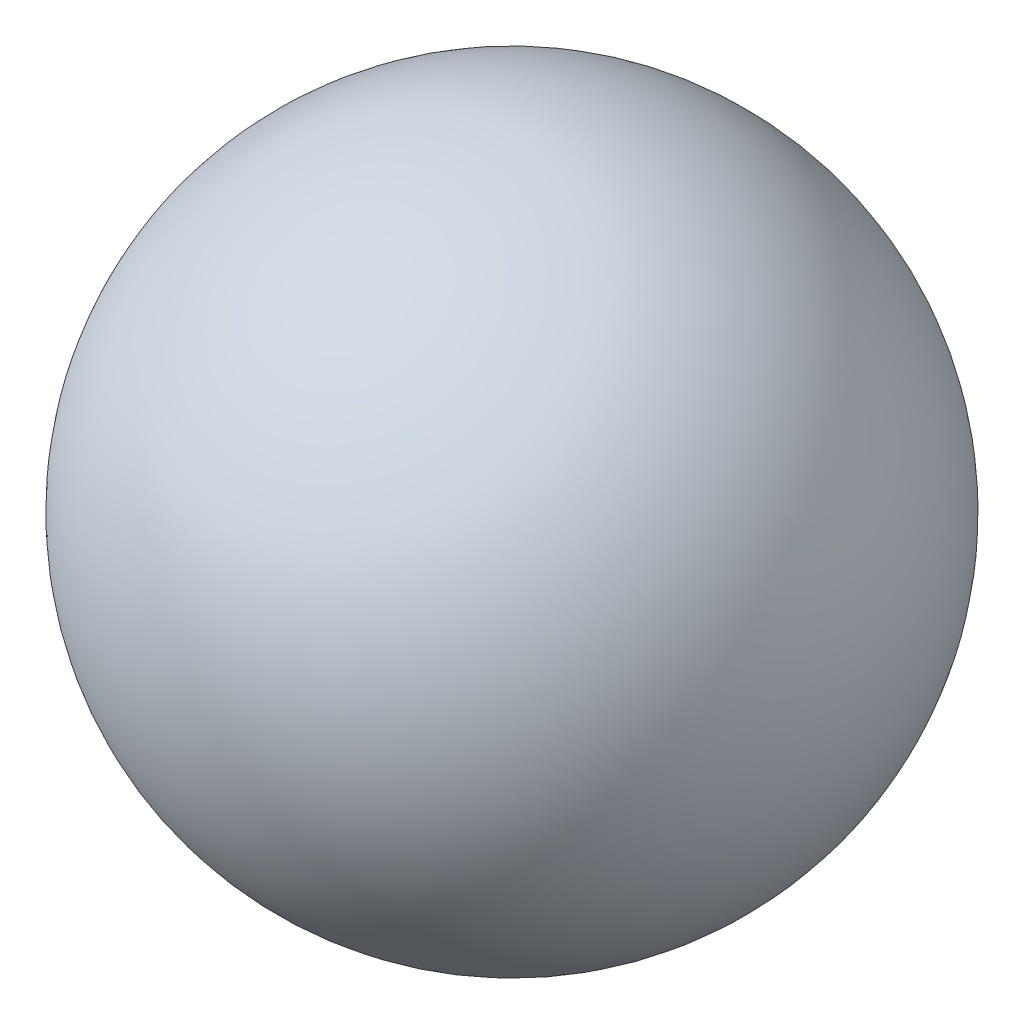
from build123d import *


with BuildPart() as part:
    # Sketch3 → Revolve1 (revolve)
    with BuildSketch(Plane.XY):
        with BuildLine():
            Line((-1.2446, 0), (1.2446, 0))
            ThreePointArc((1.2446, 0), (0, 1.2446), (-1.2446, 0))
        make_face()
    revolve(axis=Axis((-1.2446, 0, 0), (1, 0, 0)))


solid = part.part
